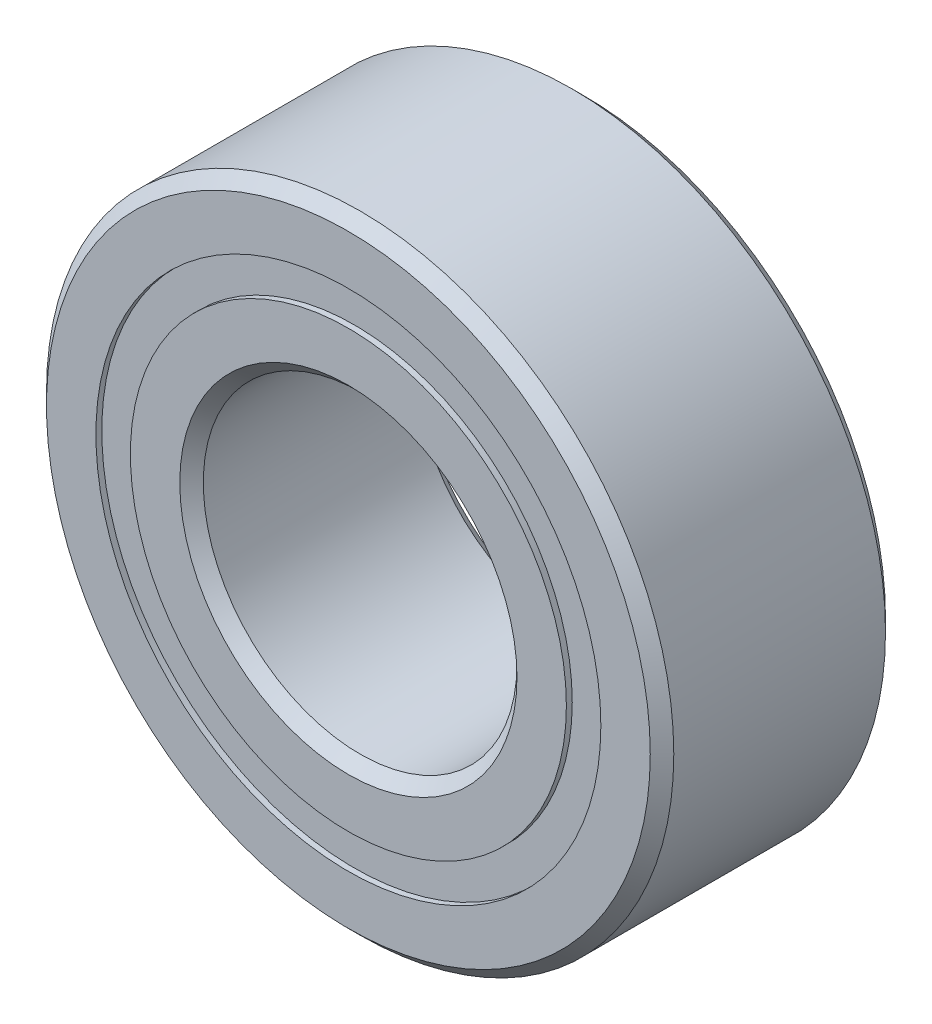
from build123d import *

# Parameters (mm, degrees)
CIRPATTERN1_COUNT = 12
SKETCH5_W         = 1.446080074
SKETCH5_H         = 0.87912088


with BuildPart() as part:
    # Sketch1 → Revolve1 (revolve)
    with BuildSketch(Plane(origin=(0, 0, 0), x_dir=(0, 0, -1), z_dir=(1, 0, 0))):
        with BuildLine():
            Line((2.7, 8), (-2.7, 8))
            Line((-2.7, 8), (-3, 7.7))
            Line((-3, 7.7), (-3, 6.43956044))
            Line((-3, 6.43956044), (-1.333333333, 6.43956044))
            ThreePointArc((-1.333333333, 6.43956044), (0, 7.403919926), (1.333333333, 6.43956044))
            Line((1.333333333, 6.43956044), (3, 6.43956044))
            Line((3, 6.43956044), (3, 7.7))
            Line((3, 7.7), (2.7, 8))
        make_face()
    revolve(axis=Axis((0, 0, 3), (0, 0, -1)))


with BuildPart() as body_2:
    # Sketch3 → Revolve3 (revolve)
    with BuildSketch(Plane(origin=(0, 0, 0), x_dir=(0, 0, -1), z_dir=(1, 0, 0))):
        with BuildLine():
            Line((-3, 5.56043956), (-1.333333333, 5.56043956))
            ThreePointArc((-1.333333333, 5.56043956), (0, 4.596080074), (1.333333333, 5.56043956))
            Line((1.333333333, 5.56043956), (3, 5.56043956))
            Line((3, 5.56043956), (3, 4.3))
            Line((3, 4.3), (2.7, 4))
            Line((2.7, 4), (-2.7, 4))
            Line((-2.7, 4), (-3, 4.3))
            Line((-3, 4.3), (-3, 5.56043956))
        make_face()
    revolve(axis=Axis((0, 0, 3), (0, 0, -1)))


with BuildPart() as body_3:
    # Sketch4 → Revolve4 (revolve)
    with BuildSketch(Plane(origin=(0, 0, 0), x_dir=(0, 0, -1), z_dir=(1, 0, 0))):
        with BuildLine():
            Line((-1.403919926, 6), (1.403919926, 6))
            ThreePointArc((1.403919926, 6), (0, 7.403919926), (-1.403919926, 6))
        make_face()
    revolve(axis=Axis((0, 6, 1.403919926), (0, 0, -1)))


with BuildPart() as cirpattern1_1:
    # CirPattern1: pattern copy
    add(body_3.part.rotate(Axis((0, 0, -3), (0, 0, 1)), 1 * 360 / CIRPATTERN1_COUNT))


with BuildPart() as cirpattern1_2:
    # CirPattern1: pattern copy
    add(body_3.part.rotate(Axis((0, 0, -3), (0, 0, 1)), 2 * 360 / CIRPATTERN1_COUNT))


with BuildPart() as cirpattern1_3:
    # CirPattern1: pattern copy
    add(body_3.part.rotate(Axis((0, 0, -3), (0, 0, 1)), 3 * 360 / CIRPATTERN1_COUNT))


with BuildPart() as cirpattern1_4:
    # CirPattern1: pattern copy
    add(body_3.part.rotate(Axis((0, 0, -3), (0, 0, 1)), 4 * 360 / CIRPATTERN1_COUNT))


with BuildPart() as cirpattern1_5:
    # CirPattern1: pattern copy
    add(body_3.part.rotate(Axis((0, 0, -3), (0, 0, 1)), 5 * 360 / CIRPATTERN1_COUNT))


with BuildPart() as cirpattern1_6:
    # CirPattern1: pattern copy
    add(body_3.part.rotate(Axis((0, 0, -3), (0, 0, 1)), 6 * 360 / CIRPATTERN1_COUNT))


with BuildPart() as cirpattern1_7:
    # CirPattern1: pattern copy
    add(body_3.part.rotate(Axis((0, 0, -3), (0, 0, 1)), 7 * 360 / CIRPATTERN1_COUNT))


with BuildPart() as cirpattern1_8:
    # CirPattern1: pattern copy
    add(body_3.part.rotate(Axis((0, 0, -3), (0, 0, 1)), 8 * 360 / CIRPATTERN1_COUNT))


with BuildPart() as cirpattern1_9:
    # CirPattern1: pattern copy
    add(body_3.part.rotate(Axis((0, 0, -3), (0, 0, 1)), 9 * 360 / CIRPATTERN1_COUNT))


with BuildPart() as cirpattern1_10:
    # CirPattern1: pattern copy
    add(body_3.part.rotate(Axis((0, 0, -3), (0, 0, 1)), 10 * 360 / CIRPATTERN1_COUNT))


with BuildPart() as cirpattern1_11:
    # CirPattern1: pattern copy
    add(body_3.part.rotate(Axis((0, 0, -3), (0, 0, 1)), 11 * 360 / CIRPATTERN1_COUNT))


with BuildPart() as body_15:
    # Sketch5 → Revolve5 (revolve)
    with BuildSketch(Plane(origin=(0, 0, 0), x_dir=(0, 0, -1), z_dir=(1, 0, 0))):
        with Locations((-2.126959963, 6)):
            Rectangle(SKETCH5_W, SKETCH5_H)
        with Locations((2.126959963, 6)):
            Rectangle(SKETCH5_W, SKETCH5_H)
    revolve(axis=Axis((0, 0, 3), (0, 0, -1)))


solid = Compound([part.part, body_2.part, body_3.part, cirpattern1_1.part, cirpattern1_2.part, cirpattern1_3.part, cirpattern1_4.part, cirpattern1_5.part, cirpattern1_6.part, cirpattern1_7.part, cirpattern1_8.part, cirpattern1_9.part, cirpattern1_10.part, cirpattern1_11.part, body_15.part])
